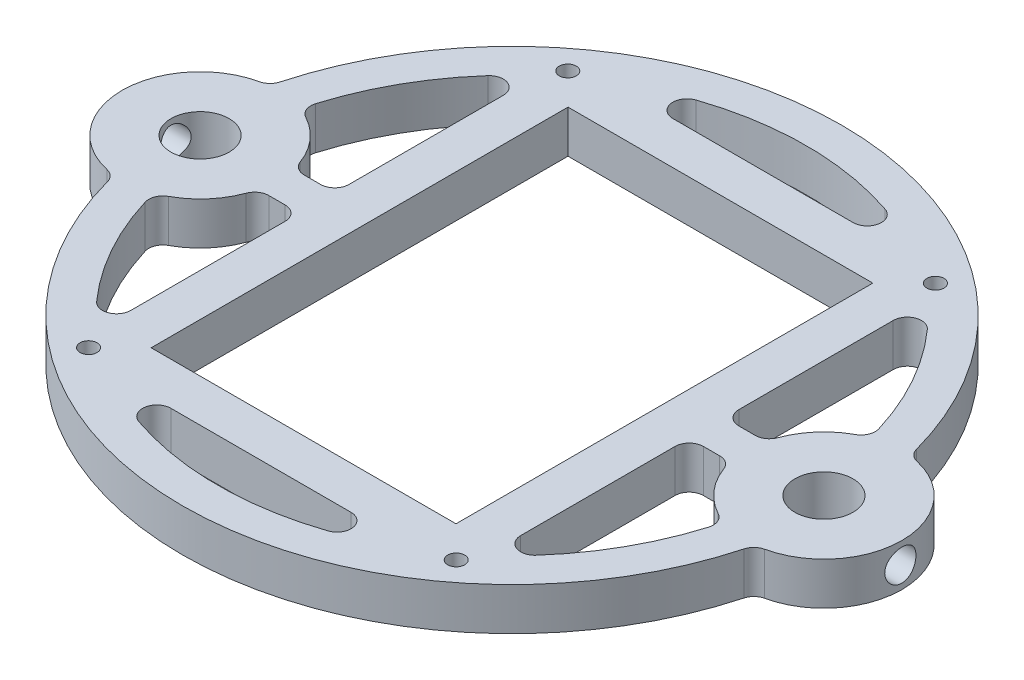
from build123d import *

# Parameters (mm, degrees)
SKETCH1_R                      = 12.7
SKETCH1_R_2                    = 3.3528
BOSS_EXTRUDE1_DEPTH            = 3.81
SKETCH2_R                      = 5.207
BOSS_EXTRUDE2_DEPTH            = 3.81
CUT_EXTRUDE1_REACH             = 85.81
CUT_EXTRUDE1_END_RADIUS        = 5.207
SKETCH3_R                      = 2.794
BOSS_EXTRUDE3_DEPTH            = 3.81
FILLET1_R                      = 2.54
SKETCH5_W                      = 69.85
SKETCH5_H                      = 89.916
SKETCH5_W_2                    = 54.61
SKETCH5_H_2                    = 74.676
BOSS_EXTRUDE4_DEPTH            = 3.81
CUT_EXTRUDE2_DEPTH             = 92.54797459
CUT_EXTRUDE2_DEPTH_BACK        = 92.54797459
SKETCH6_W                      = 54.61
SKETCH6_H                      = 74.676
FILLET2_R                      = 2.54
CUT_EXTRUDE3_REACH             = 93.786
SKETCH7_R                      = 1.524
CUT_EXTRUDE3_DIRECTION_2_DEPTH = 92.785510579


with BuildPart() as part:
    # Sketch1 → Boss-Extrude1 (new, symmetric)
    with BuildSketch(Plane(origin=(0, 0, 0), x_dir=(1, 0, 0), z_dir=(0, 1, 0))):
        with Locations(Location((0, 0, 0), (0, 0, 90))):
            Circle(SKETCH1_R)
        with Locations(Location((0, 0, 0), (0, 0, 90))):
            Circle(SKETCH1_R_2, mode=Mode.SUBTRACT)
    extrude(amount=BOSS_EXTRUDE1_DEPTH, both=True)

    # Sketch2 → Boss-Extrude2 (add, symmetric)
    with BuildSketch(Plane(origin=(0, 0, 0), x_dir=(1, 0, 0), z_dir=(0, 1, 0))):
        with BuildLine():
            Line((12.296722124, 3.175), (42.275578844, 3.175))
            ThreePointArc((42.275578844, 3.175), (69.85, 0), (42.275578844, -3.175))
            Line((42.275578844, -3.175), (12.296722124, -3.175))
            ThreePointArc((12.296722124, -3.175), (12.7, 0), (12.296722124, 3.175))
        make_face()
        with Locations(Location((55.88, 0, 0), (0, 0, 90))):
            Circle(SKETCH2_R, mode=Mode.SUBTRACT)
    boss_extrude2 = extrude(amount=BOSS_EXTRUDE2_DEPTH, both=True)

    # Cut-Extrude1: up to this cylinder (the profile starts outside it)
    cut_extrude1_end = Plane(origin=(55.88, 0, 0), z_dir=(0, -1, 0)) * Cylinder(CUT_EXTRUDE1_END_RADIUS, 183.034, mode=Mode.PRIVATE)
    # Sketch3 → Cut-Extrude1 (cut, up to the surface)
    with BuildSketch(Plane(origin=(69.85, 0, 0), x_dir=(0, 0, -1), z_dir=(1, 0, 0)), mode=Mode.PRIVATE) as cut_extrude1_sk1:
        Circle(SKETCH3_R)
    cut_extrude1_tool1 = extrude(cut_extrude1_sk1.sketch, amount=-CUT_EXTRUDE1_REACH, mode=Mode.PRIVATE) - cut_extrude1_end
    cut_extrude1 = cut_extrude1_tool1.solids().sort_by_distance((69.85, 0, 0))[0]
    add(cut_extrude1, mode=Mode.SUBTRACT)

    # Mirror1: Boss-Extrude2, Cut-Extrude1 across plane
    add(boss_extrude2.mirror(Plane(origin=(0, 0, 0), x_dir=(0, 0, 1), z_dir=(1, 0, 0))))
    add(cut_extrude1.mirror(Plane(origin=(0, 0, 0), x_dir=(0, 0, 1), z_dir=(1, 0, 0))), mode=Mode.SUBTRACT)

    # Sketch4 → Boss-Extrude3 (add, symmetric)
    with BuildSketch(Plane(origin=(0, 0, 0), x_dir=(1, 0, 0), z_dir=(0, 1, 0))):
        with BuildLine():
            ThreePointArc((-51.048948864, -13.10808319), (-54.178749787, -13.866024943), (-57.398948864, -13.887177336))
            ThreePointArc((-57.398948864, -13.887177336), (0, -59.055), (57.398948864, -13.887177336))
            ThreePointArc((57.398948864, -13.887177336), (54.178749787, -13.866024943), (51.048948864, -13.10808319))
            ThreePointArc((51.048948864, -13.10808319), (0, -52.705), (-51.048948864, -13.10808319))
        make_face()
        with BuildLine():
            ThreePointArc((57.398948864, 13.887177336), (0, 59.055), (-57.398948864, 13.887177336))
            ThreePointArc((-57.398948864, 13.887177336), (-54.178749787, 13.866024943), (-51.048948864, 13.10808319))
            ThreePointArc((-51.048948864, 13.10808319), (0, 52.705), (51.048948864, 13.10808319))
            ThreePointArc((51.048948864, 13.10808319), (54.178749787, 13.866024943), (57.398948864, 13.887177336))
        make_face()
    extrude(amount=BOSS_EXTRUDE3_DEPTH, both=True)

    # Fillet1
    fillet1_edges = [part.edges().sort_by_distance(p)[0] for p in [
        (12.296722124, 0, -3.175),
        (12.296722124, 0, 3.175),
        (42.275578844, 0, 3.175),
        (42.275578844, 0, -3.175),
        (-12.296722124, 0, 3.175),
        (-12.296722124, 0, -3.175),
        (-42.275578844, 0, -3.175),
        (-42.275578844, 0, 3.175),
        (-51.048948864, 0, 13.10808319),
        (-57.398948864, 0, 13.887177336),
        (57.398948864, 0, 13.887177336),
        (51.048948864, 0, 13.10808319),
        (51.048948864, 0, -13.10808319),
        (57.398948864, 0, -13.887177336),
        (-57.398948864, 0, -13.887177336),
        (-51.048948864, 0, -13.10808319),
    ]]
    fillet(fillet1_edges, radius=FILLET1_R)

    # Sketch5 → Boss-Extrude4 (add, symmetric)
    with BuildSketch(Plane(origin=(0, 0, 0), x_dir=(1, 0, 0), z_dir=(0, 1, 0))):
        Rectangle(SKETCH5_W, SKETCH5_H)
        Rectangle(SKETCH5_W_2, SKETCH5_H_2, mode=Mode.SUBTRACT)
    extrude(amount=BOSS_EXTRUDE4_DEPTH, both=True)

    # Sketch6 → Cut-Extrude2 (cut, two sides: drawn at the far end of the back side and taken through both)
    with BuildSketch(Plane(origin=(0, 0, 0), x_dir=(1, 0, 0), z_dir=(0, 1, 0)).offset(-CUT_EXTRUDE2_DEPTH_BACK)):
        Rectangle(SKETCH6_W, SKETCH6_H)
    extrude(amount=CUT_EXTRUDE2_DEPTH + CUT_EXTRUDE2_DEPTH_BACK, mode=Mode.SUBTRACT)

    # Fillet2
    fillet2_edges = [part.edges().sort_by_distance(p)[0] for p in [
        (-34.925, 0, -39.472286481),
        (27.506276756, 0, -44.958),
        (-27.506276756, 0, -44.958),
        (34.925, 0, -39.472286481),
        (-27.506276756, 0, 44.958),
        (27.506276756, 0, 44.958),
        (34.925, 0, 3.175),
        (34.925, 0, -3.175),
        (34.925, 0, 39.472286481),
        (-34.925, 0, -3.175),
        (-34.925, 0, 3.175),
        (-34.925, 0, 39.472286481),
    ]]
    fillet(fillet2_edges, radius=FILLET2_R)

    # Sketch7 → Cut-Extrude3 (cut, up to next)
    with BuildSketch(Plane(origin=(0, 3.81, 0), x_dir=(1, 0, 0), z_dir=(0, 1, 0)), mode=Mode.PRIVATE) as cut_extrude3_sk1:
        with Locations(Location((-32.9311, 42.926, 0), (0, 0, 90))):
            Circle(SKETCH7_R)
    cut_extrude3_tool1 = extrude(cut_extrude3_sk1.sketch, amount=-CUT_EXTRUDE3_REACH, mode=Mode.PRIVATE) & part.part
    # Sketch7 → Cut-Extrude3 (cut, up to next)
    with BuildSketch(Plane(origin=(0, 3.81, 0), x_dir=(1, 0, 0), z_dir=(0, 1, 0)), mode=Mode.PRIVATE) as cut_extrude3_sk2:
        with Locations(Location((32.9311, 42.926, 0), (0, 0, 90))):
            Circle(SKETCH7_R)
    cut_extrude3_tool2 = extrude(cut_extrude3_sk2.sketch, amount=-CUT_EXTRUDE3_REACH, mode=Mode.PRIVATE) & part.part
    # Sketch7 → Cut-Extrude3 (cut, up to next)
    with BuildSketch(Plane(origin=(0, 3.81, 0), x_dir=(1, 0, 0), z_dir=(0, 1, 0)), mode=Mode.PRIVATE) as cut_extrude3_sk3:
        with Locations(Location((32.9311, -42.926, 0), (0, 0, 90))):
            Circle(SKETCH7_R)
    cut_extrude3_tool3 = extrude(cut_extrude3_sk3.sketch, amount=-CUT_EXTRUDE3_REACH, mode=Mode.PRIVATE) & part.part
    # Sketch7 → Cut-Extrude3 (cut, up to next)
    with BuildSketch(Plane(origin=(0, 3.81, 0), x_dir=(1, 0, 0), z_dir=(0, 1, 0)), mode=Mode.PRIVATE) as cut_extrude3_sk4:
        with Locations(Location((-32.9311, -42.926, 0), (0, 0, 90))):
            Circle(SKETCH7_R)
    cut_extrude3_tool4 = extrude(cut_extrude3_sk4.sketch, amount=-CUT_EXTRUDE3_REACH, mode=Mode.PRIVATE) & part.part
    add(cut_extrude3_tool1.solids().sort_by_distance((-32.9311, 3.81, -42.926))[0], mode=Mode.SUBTRACT)
    add(cut_extrude3_tool2.solids().sort_by_distance((32.9311, 3.81, -42.926))[0], mode=Mode.SUBTRACT)
    add(cut_extrude3_tool3.solids().sort_by_distance((32.9311, 3.81, 42.926))[0], mode=Mode.SUBTRACT)
    add(cut_extrude3_tool4.solids().sort_by_distance((-32.9311, 3.81, 42.926))[0], mode=Mode.SUBTRACT)

    # Sketch7 → Cut-Extrude3 direction 2 (cut)
    with BuildSketch(Plane(origin=(0, 3.81, 0), x_dir=(1, 0, 0), z_dir=(0, 1, 0))):
        with Locations(Location((-32.9311, 42.926, 0), (0, 0, 90))):
            Circle(SKETCH7_R)
        with Locations(Location((32.9311, 42.926, 0), (0, 0, 90))):
            Circle(SKETCH7_R)
        with Locations(Location((32.9311, -42.926, 0), (0, 0, 90))):
            Circle(SKETCH7_R)
        with Locations(Location((-32.9311, -42.926, 0), (0, 0, 90))):
            Circle(SKETCH7_R)
    extrude(amount=CUT_EXTRUDE3_DIRECTION_2_DEPTH, mode=Mode.SUBTRACT)


solid = part.part
